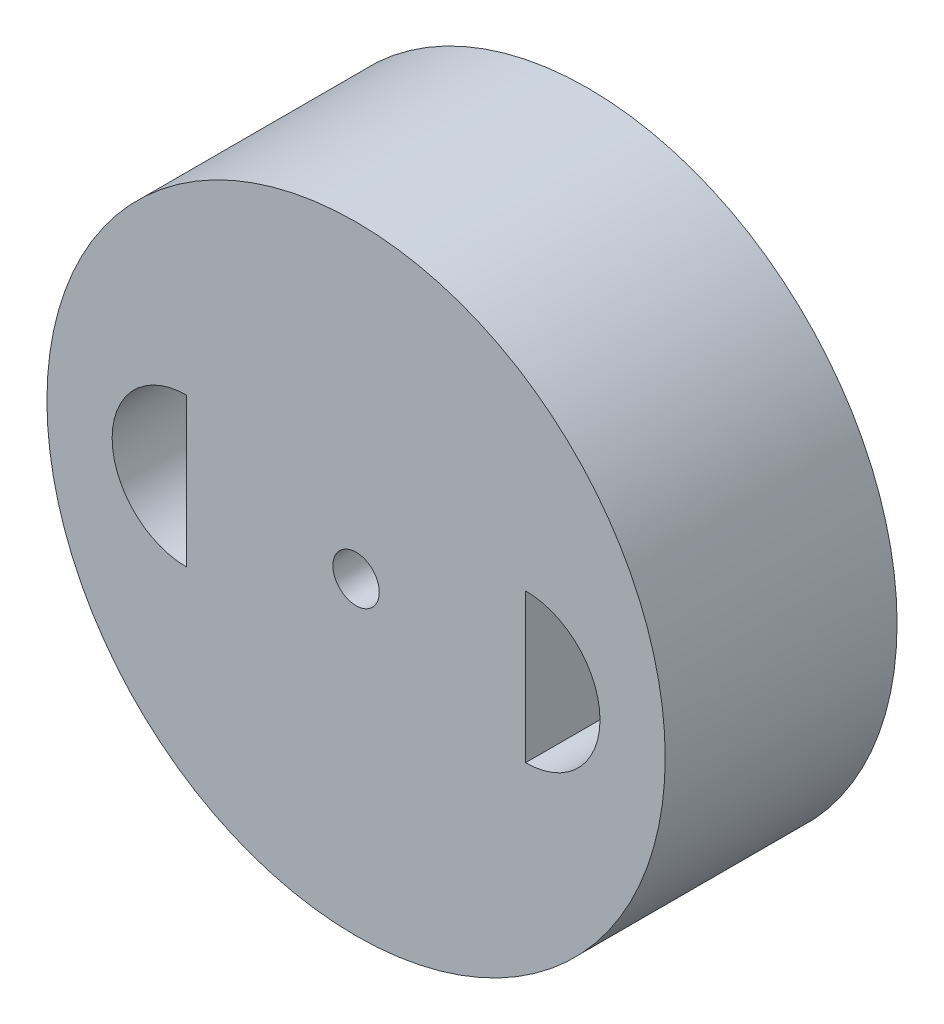
from build123d import *

# Parameters (mm, degrees)
SKETCH1_R               = 101.6
BOSS_EXTRUDE1_DEPTH     = 76.2
CUT_EXTRUDE7_DEPTH      = 163.639355631
CUT_EXTRUDE7_DEPTH_BACK = 163.639355631
SKETCH3_R               = 7.62
CUT_EXTRUDE8_DEPTH      = 163.639355631


with BuildPart() as part:
    # Sketch1 → Boss-Extrude1 (new body)
    with BuildSketch(Plane.XY):
        with Locations(Location((0, 0, 0), (0, 0, 180))):
            Circle(SKETCH1_R)
    extrude(amount=BOSS_EXTRUDE1_DEPTH)

    # Sketch2 → Cut-Extrude7 (cut, two sides: drawn at the far end of the back side and taken through both)
    with BuildSketch(Plane.XY.offset(76.2).offset(-CUT_EXTRUDE7_DEPTH_BACK)):
        with BuildLine():
            ThreePointArc((-55.703026842, -24.462175809), (-80.165202651, 0), (-55.703026842, 24.462175809))
            Line((-55.703026842, 24.462175809), (-55.703026842, -24.462175809))
        make_face()
        with BuildLine():
            Line((55.703026842, 24.462175809), (55.703026842, -24.462175809))
            ThreePointArc((55.703026842, -24.462175809), (80.165202651, 0), (55.703026842, 24.462175809))
        make_face()
    extrude(amount=CUT_EXTRUDE7_DEPTH + CUT_EXTRUDE7_DEPTH_BACK, mode=Mode.SUBTRACT)

    # Sketch3 → Cut-Extrude8 (cut, through all)
    with BuildSketch(Plane.XY.offset(76.2)):
        Circle(SKETCH3_R)
    extrude(amount=-CUT_EXTRUDE8_DEPTH, mode=Mode.SUBTRACT)


solid = part.part
